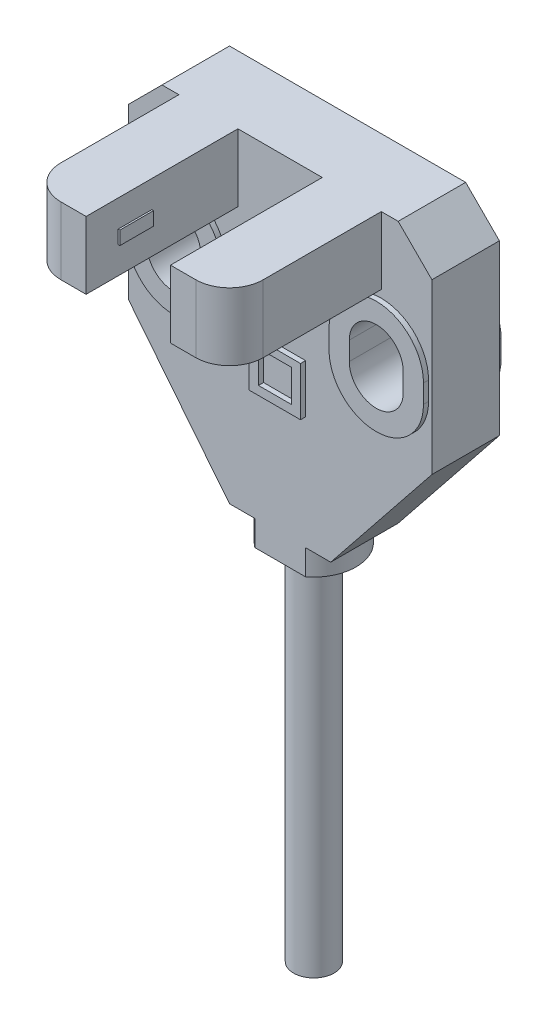
from build123d import *

# Parameters (mm, degrees)
EXTRUDE_1_DEPTH     = 4
EXTRUDE_2_DEPTH     = 4
EXTRUDE_3_DEPTH     = 1.5
SKETCH_4_R          = 1.2
EXTRUDE_4_DEPTH     = 21.5
CHAMFER_1_SIZE      = 2
SKETCH_5_W          = 2
SKETCH_5_H          = 0.8
EXTRUDE_7_DEPTH     = 0.1
SKETCH_6_W          = 2
SKETCH_6_H          = 0.8
CUT_EXTRUDE_2_DEPTH = 0.1
CUT_EXTRUDE_3_REACH = 46.365
EXTRUDE_START       = 0.3
EXTRUDE_8_DEPTH     = 0.3
EXTRUDE_9_DEPTH     = 0.3
SKETCH_10_W         = 3.044276786
SKETCH_10_H         = 2.889483051
SKETCH_10_W_2       = 1.964865926
SKETCH_10_H_2       = 1.90912273
EXTRUDE_10_DEPTH    = 0.3


with BuildPart() as part:
    # 草圖1 → 伸長1 (new body)
    with BuildSketch(Plane.XY):
        Polygon((-9, 0), (9, 0), (9, -12), (3, -19.5), (-3, -19.5), (-9, -12), align=None)
    extrude(amount=EXTRUDE_1_DEPTH)

    # 草圖2 → 伸長2 (add)
    with BuildSketch(Plane(origin=(0, 0, 0), x_dir=(1, 0, 0), z_dir=(0, 1, 0))):
        with BuildLine():
            Line((-6, -4), (-2.5, -4))
            Line((-2.5, -4), (-2.5, -13))
            Line((-2.5, -13), (-4, -13))
            ThreePointArc((-4, -13), (-5.414213562, -12.414213562), (-6, -11))
            Line((-6, -11), (-6, -4))
        make_face()
        with BuildLine():
            Line((2.5, -4), (6, -4))
            Line((6, -4), (6, -11))
            ThreePointArc((6, -11), (5.414213562, -12.414213562), (4, -13))
            Line((4, -13), (2.5, -13))
            Line((2.5, -13), (2.5, -4))
        make_face()
    extrude(amount=-EXTRUDE_2_DEPTH)

    # 草圖3 → 伸長3 (add)
    with BuildSketch(Plane.XZ.offset(19.5)):
        with BuildLine():
            Line((-1.5, 0), (1.5, 0))
            ThreePointArc((1.5, 0), (2.5, 2), (1.5, 4))
            Line((1.5, 4), (-1.5, 4))
            ThreePointArc((-1.5, 4), (-2.5, 2), (-1.5, 0))
        make_face()
    extrude(amount=EXTRUDE_3_DEPTH)

    # 草圖4 → 伸長4 (add)
    with BuildSketch(Plane.XZ.offset(21)):
        with Locations(Location((0, 2, 0), (0, 0, 270))):
            Circle(SKETCH_4_R)
    extrude(amount=EXTRUDE_4_DEPTH)

    # 導角1
    chamfer_1_edges = [part.edges().sort_by_distance(p)[0] for p in [
        (9, 0, 2),
        (-9, 0, 2),
    ]]
    chamfer(chamfer_1_edges, length=CHAMFER_1_SIZE)

    # 草圖5 → 伸長7 (add)
    with BuildSketch(Plane(origin=(-2.5, 0, 0), x_dir=(0, 0, -1), z_dir=(1, 0, 0))):
        with Locations((-10.1, -2)):
            Rectangle(SKETCH_5_W, SKETCH_5_H)
    extrude(amount=EXTRUDE_7_DEPTH)

    # 草圖6 → 除料-伸長2 (cut)
    with BuildSketch(Plane.ZY.offset(-2.5)):
        with Locations((10.1, -2)):
            Rectangle(SKETCH_6_W, SKETCH_6_H)
    extrude(amount=-CUT_EXTRUDE_2_DEPTH, mode=Mode.SUBTRACT)

    # 草圖7 → 除料-伸長3 (cut, up to next)
    with BuildSketch(Plane.XY.offset(4), mode=Mode.PRIVATE) as cut_extrude_3_sk1:
        with BuildLine():
            Line((-7.6, -7.25), (-7.6, -8.35))
            ThreePointArc((-7.6, -8.35), (-6, -9.95), (-4.4, -8.35))
            Line((-4.4, -8.35), (-4.4, -7.25))
            ThreePointArc((-4.4, -7.25), (-6, -5.65), (-7.6, -7.25))
        make_face()
    cut_extrude_3_tool1 = extrude(cut_extrude_3_sk1.sketch, amount=-CUT_EXTRUDE_3_REACH, mode=Mode.PRIVATE) & part.part
    # 草圖7 → 除料-伸長3 (cut, up to next)
    with BuildSketch(Plane.XY.offset(4), mode=Mode.PRIVATE) as cut_extrude_3_sk2:
        with BuildLine():
            Line((4.4, -7.25), (4.4, -8.35))
            ThreePointArc((4.4, -8.35), (6, -9.95), (7.6, -8.35))
            Line((7.6, -8.35), (7.6, -7.25))
            ThreePointArc((7.6, -7.25), (6, -5.65), (4.4, -7.25))
        make_face()
    cut_extrude_3_tool2 = extrude(cut_extrude_3_sk2.sketch, amount=-CUT_EXTRUDE_3_REACH, mode=Mode.PRIVATE) & part.part
    add(cut_extrude_3_tool1.solids().sort_by_distance((-6, -7.8, 4))[0], mode=Mode.SUBTRACT)
    add(cut_extrude_3_tool2.solids().sort_by_distance((6, -7.8, 4))[0], mode=Mode.SUBTRACT)

    # 草圖8 → 伸長8 (add)
    # profile 1 of 2: a face of its own
    with BuildSketch(Plane.XY.offset(4).offset(EXTRUDE_START)):
        with BuildLine():
            Line((3.2, -7.25), (3.2, -8.35))
            ThreePointArc((3.2, -8.35), (6, -11.15), (8.8, -8.35))
            Line((8.8, -8.35), (8.8, -7.25))
            ThreePointArc((8.8, -7.25), (6, -4.45), (3.2, -7.25))
        make_face()
        with BuildLine():
            Line((4.4, -7.25), (4.4, -8.35))
            ThreePointArc((4.4, -8.35), (6, -9.95), (7.6, -8.35))
            Line((7.6, -8.35), (7.6, -7.25))
            ThreePointArc((7.6, -7.25), (6, -5.65), (4.4, -7.25))
        make_face(mode=Mode.SUBTRACT)
    # profile 2 of 2: a face of its own
    with BuildSketch(Plane.XY.offset(4).offset(EXTRUDE_START)):
        with BuildLine():
            Line((-8.8, -7.25), (-8.8, -8.35))
            ThreePointArc((-8.8, -8.35), (-6, -11.15), (-3.2, -8.35))
            Line((-3.2, -8.35), (-3.2, -7.25))
            ThreePointArc((-3.2, -7.25), (-6, -4.45), (-8.8, -7.25))
        make_face()
        with BuildLine():
            Line((-7.6, -7.25), (-7.6, -8.35))
            ThreePointArc((-7.6, -8.35), (-6, -9.95), (-4.4, -8.35))
            Line((-4.4, -8.35), (-4.4, -7.25))
            ThreePointArc((-4.4, -7.25), (-6, -5.65), (-7.6, -7.25))
        make_face(mode=Mode.SUBTRACT)
    extrude(amount=-EXTRUDE_8_DEPTH)

    # 草圖9 → 伸長9 (add)
    # profile 1 of 2: a face of its own
    with BuildSketch(Plane(origin=(0, 0, 0), x_dir=(-1, 0, 0), z_dir=(0, 0, -1))):
        with BuildLine():
            Line((-3.2, -8.35), (-3.2, -7.25))
            ThreePointArc((-3.2, -7.25), (-6, -4.45), (-8.8, -7.25))
            Line((-8.8, -7.25), (-8.8, -8.35))
            ThreePointArc((-8.8, -8.35), (-6, -11.15), (-3.2, -8.35))
        make_face()
        with BuildLine():
            Line((-4.4, -8.35), (-4.4, -7.25))
            ThreePointArc((-4.4, -7.25), (-6, -5.65), (-7.6, -7.25))
            Line((-7.6, -7.25), (-7.6, -8.35))
            ThreePointArc((-7.6, -8.35), (-6, -9.95), (-4.4, -8.35))
        make_face(mode=Mode.SUBTRACT)
    # profile 2 of 2: a face of its own
    with BuildSketch(Plane(origin=(0, 0, 0), x_dir=(-1, 0, 0), z_dir=(0, 0, -1))):
        with BuildLine():
            Line((8.8, -8.35), (8.8, -7.25))
            ThreePointArc((8.8, -7.25), (6, -4.45), (3.2, -7.25))
            Line((3.2, -7.25), (3.2, -8.35))
            ThreePointArc((3.2, -8.35), (6, -11.15), (8.8, -8.35))
        make_face()
        with BuildLine():
            Line((7.6, -8.35), (7.6, -7.25))
            ThreePointArc((7.6, -7.25), (6, -5.65), (4.4, -7.25))
            Line((4.4, -7.25), (4.4, -8.35))
            ThreePointArc((4.4, -8.35), (6, -9.95), (7.6, -8.35))
        make_face(mode=Mode.SUBTRACT)
    extrude(amount=EXTRUDE_9_DEPTH)

    # 草圖10 → 伸長10 (add)
    with BuildSketch(Plane.XY.offset(4)):
        with Locations((-0.011782979, -11.3393837)):
            Rectangle(SKETCH_10_W, SKETCH_10_H)
        with Locations((0, -11.313584744)):
            Rectangle(SKETCH_10_W_2, SKETCH_10_H_2, mode=Mode.SUBTRACT)
    extrude(amount=EXTRUDE_10_DEPTH)


solid = part.part
